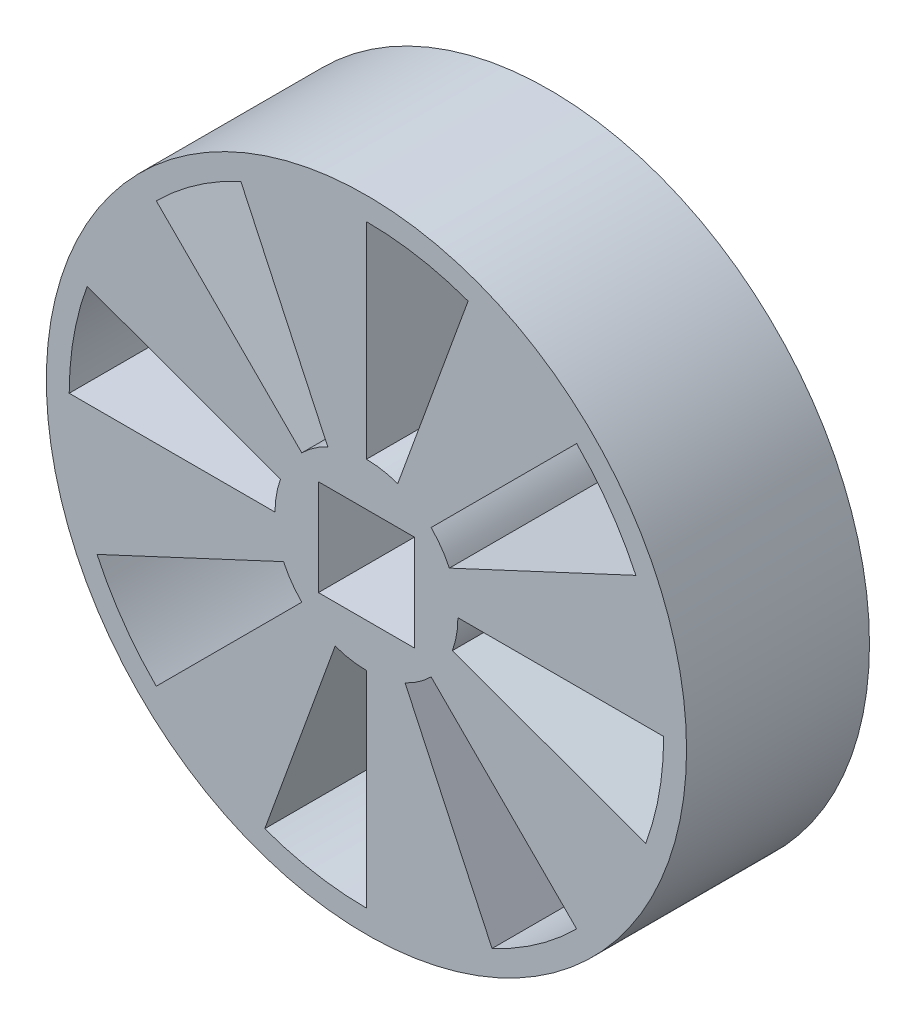
from build123d import *

# Parameters (mm, degrees)
SKETCH_2_R      = 35
SKETCH_2_W      = 10.5
SKETCH_2_H      = 10.5
EXTRUDE_1_DEPTH = 20


with BuildPart() as part:
    # Эскиз2 → Бобышка-Вытянуть1 (new body)
    with BuildSketch(Plane.XY):
        Circle(SKETCH_2_R)
        with BuildLine():
            ThreePointArc((-30.540010176, 11.115654658), (-32.006251973, 5.643565774), (-32.5, 0))
            Line((-32.5, 0), (-10, 0))
            ThreePointArc((-10, 0), (-9.84807753, 1.736481777), (-9.396926208, 3.420201433))
            Line((-9.396926208, 3.420201433), (-30.540010176, 11.115654658))
        make_face(mode=Mode.SUBTRACT)
        with BuildLine():
            ThreePointArc((-11.115654658, -30.540010176), (-5.643565774, -32.006251973), (0, -32.5))
            Line((0, -32.5), (0, -10))
            ThreePointArc((0, -10), (-1.736481777, -9.84807753), (-3.420201433, -9.396926208))
            Line((-3.420201433, -9.396926208), (-11.115654658, -30.540010176))
        make_face(mode=Mode.SUBTRACT)
        with BuildLine():
            ThreePointArc((30.540010176, -11.115654658), (32.006251973, -5.643565774), (32.5, 0))
            Line((32.5, 0), (10, 0))
            ThreePointArc((10, 0), (9.84807753, -1.736481777), (9.396926208, -3.420201433))
            Line((9.396926208, -3.420201433), (30.540010176, -11.115654658))
        make_face(mode=Mode.SUBTRACT)
        with BuildLine():
            ThreePointArc((-13.735093507, 29.455003079), (-18.641234181, 26.622441439), (-22.980970389, 22.980970389))
            Line((-22.980970389, 22.980970389), (-7.071067812, 7.071067812))
            ThreePointArc((-7.071067812, 7.071067812), (-5.735764364, 8.191520443), (-4.226182617, 9.06307787))
            Line((-4.226182617, 9.06307787), (-13.735093507, 29.455003079))
        make_face(mode=Mode.SUBTRACT)
        Rectangle(SKETCH_2_W, SKETCH_2_H, mode=Mode.SUBTRACT)
        with BuildLine():
            Line((0, 10), (0, 32.5))
            ThreePointArc((0, 32.5), (5.643565774, 32.006251973), (11.115654658, 30.540010176))
            Line((11.115654658, 30.540010176), (3.420201433, 9.396926208))
            ThreePointArc((3.420201433, 9.396926208), (1.736481777, 9.84807753), (0, 10))
        make_face(mode=Mode.SUBTRACT)
        with BuildLine():
            Line((9.06307787, 4.226182617), (29.455003079, 13.735093507))
            ThreePointArc((29.455003079, 13.735093507), (26.622441439, 18.641234181), (22.980970389, 22.980970389))
            Line((22.980970389, 22.980970389), (7.071067812, 7.071067812))
            ThreePointArc((7.071067812, 7.071067812), (8.191520443, 5.735764364), (9.06307787, 4.226182617))
        make_face(mode=Mode.SUBTRACT)
        with BuildLine():
            Line((4.226182617, -9.06307787), (13.735093507, -29.455003079))
            ThreePointArc((13.735093507, -29.455003079), (18.641234181, -26.622441439), (22.980970389, -22.980970389))
            Line((22.980970389, -22.980970389), (7.071067812, -7.071067812))
            ThreePointArc((7.071067812, -7.071067812), (5.735764364, -8.191520443), (4.226182617, -9.06307787))
        make_face(mode=Mode.SUBTRACT)
        with BuildLine():
            Line((-9.06307787, -4.226182617), (-29.455003079, -13.735093507))
            ThreePointArc((-29.455003079, -13.735093507), (-26.622441439, -18.641234181), (-22.980970389, -22.980970389))
            Line((-22.980970389, -22.980970389), (-7.071067812, -7.071067812))
            ThreePointArc((-7.071067812, -7.071067812), (-8.191520443, -5.735764364), (-9.06307787, -4.226182617))
        make_face(mode=Mode.SUBTRACT)
    extrude(amount=EXTRUDE_1_DEPTH)


solid = part.part
